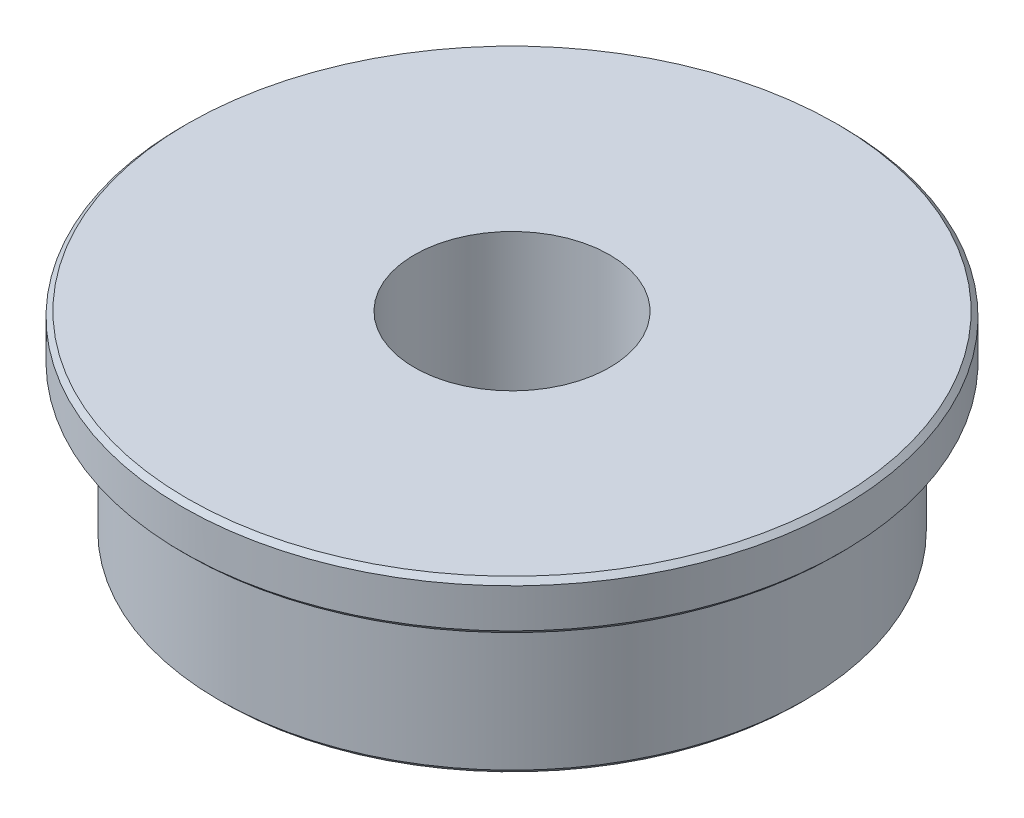
from build123d import *

# Parameters (mm, degrees)
CHAMFER_1_SIZE = 0.1


with BuildPart() as part:
    # 草图1 → 旋转1 (revolve)
    with BuildSketch(Plane.XY, mode=Mode.PRIVATE) as revolve_1_sk:
        Polygon((2, 0), (2, 4), (6.75, 4), (6.75, 3), (6, 3), (6, 0), align=None)
    revolve(revolve_1_sk.sketch.rotate(Axis((0, 0, 0), (0, 1, 0)), 90), axis=Axis((0, 0, 0), (0, 1, 0)))

    # 倒角1
    chamfer_1_edges = [part.edges().sort_by_distance(p)[0] for p in [
        (0, 0, 6),
        (0, 3, 6.75),
        (0, 4, 6.75),
    ]]
    chamfer(chamfer_1_edges, length=CHAMFER_1_SIZE)


solid = part.part
